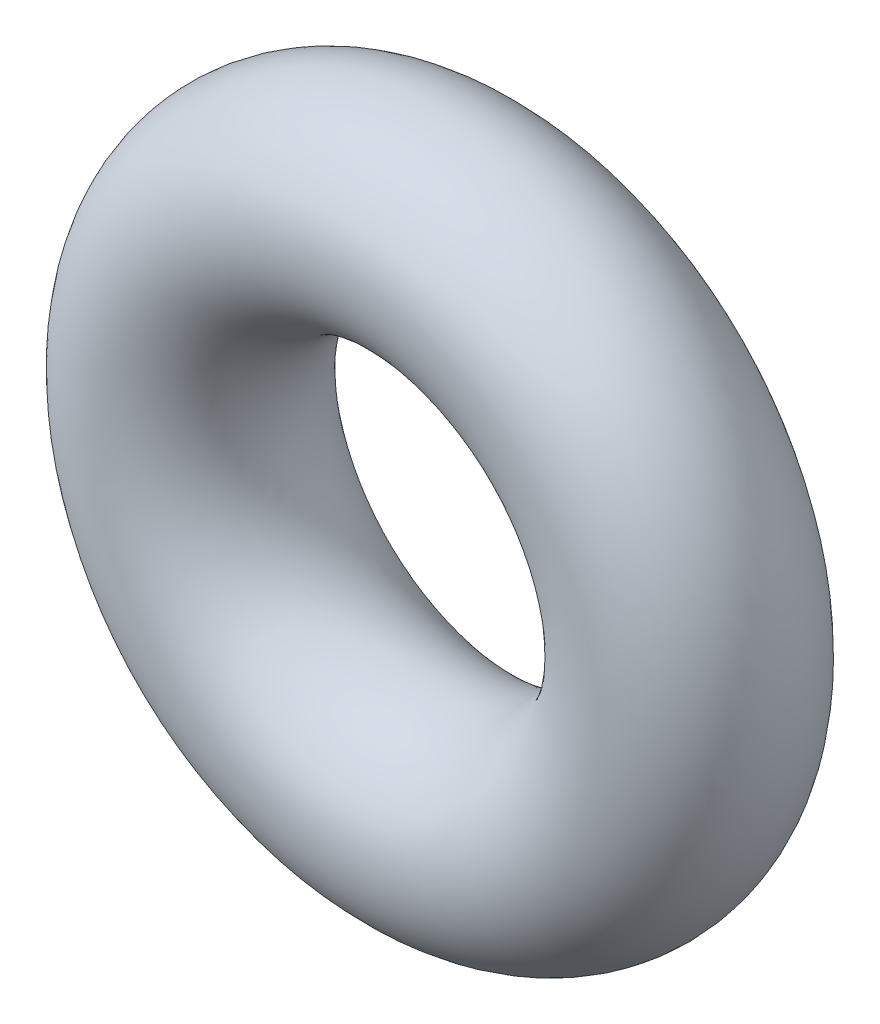
from build123d import *

# Parameters (mm, degrees)
SKETCH1_R = 0.889


with BuildPart() as part:
    # Sketch1 → Revolve1 (revolve)
    with BuildSketch(Plane(origin=(0, 0, 0), x_dir=(0, -1, 0), z_dir=(1, 0, 0)), mode=Mode.PRIVATE) as revolve1_sk:
        with Locations((2.1717, 0)):
            Circle(SKETCH1_R)
    revolve(revolve1_sk.sketch.rotate(Axis((0, 0, 0.889), (0, 0, -1)), 270), axis=Axis((0, 0, 0.889), (0, 0, -1)))


solid = part.part
